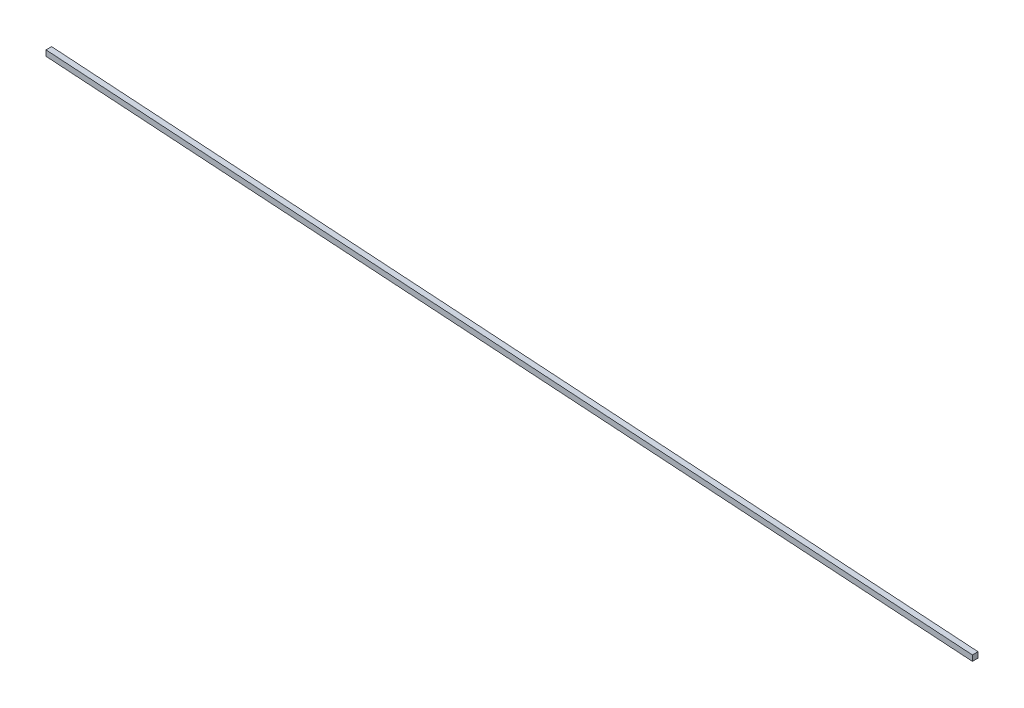
from build123d import *

# Parameters (mm, degrees)
EXTRUDE_1_DEPTH = 3


with BuildPart() as part:
    # Model → 凸台-拉伸1 (new body)
    with BuildSketch(Plane.XY):
        Polygon((8.80082432, 36.066218197), (503.80082432, 3.565620492), (503.80082432, 0.565620492), (8.80082432, 33.066218197), align=None)
    extrude(amount=EXTRUDE_1_DEPTH)


solid = part.part
